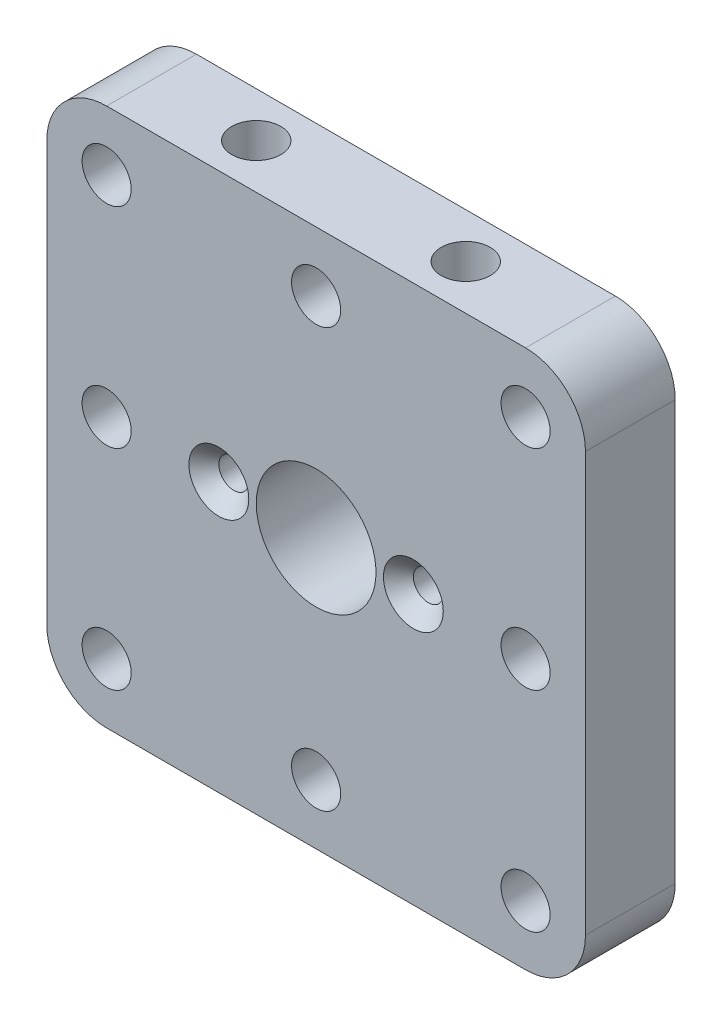
from build123d import *

# Parameters (mm, degrees)
SKETCH1_W           = 57.15
SKETCH1_H           = 57.15
SKETCH1_R           = 2.6035
SKETCH1_R_2         = 6.35
SKETCH1_R_3         = 1.5875
BOSS_EXTRUDE1_DEPTH = 9.525
CHAMFER1_SIZE       = 1.5875
FILLET1_R           = 6.35
SKETCH2_R           = 2.6035
CUT_EXTRUDE1_DEPTH  = 12.7


with BuildPart() as part:
    # Sketch1 → Boss-Extrude1 (new body)
    with BuildSketch(Plane.XY.offset(579.576994876)):
        with Locations((0, 762.756140976)):
            Rectangle(SKETCH1_W, SKETCH1_H)
        with Locations(Location((-22.225, 784.981140976, 0), (0, 0, 180))):
            Circle(SKETCH1_R, mode=Mode.SUBTRACT)
        with Locations(Location((0, 762.756140976, 0), (0, 0, 180))):
            Circle(SKETCH1_R_2, mode=Mode.SUBTRACT)
        with Locations(Location((-10.31875, 762.756140976, 0), (0, 0, 180))):
            Circle(SKETCH1_R_3, mode=Mode.SUBTRACT)
        with Locations(Location((10.31875, 762.756140976, 0), (0, 0, 180))):
            Circle(SKETCH1_R_3, mode=Mode.SUBTRACT)
        with Locations(Location((22.225, 784.981140976, 0), (0, 0, 180))):
            Circle(SKETCH1_R, mode=Mode.SUBTRACT)
        with Locations(Location((22.225, 762.756140976, 0), (0, 0, 180))):
            Circle(SKETCH1_R, mode=Mode.SUBTRACT)
        with Locations(Location((0, 784.981140976, 0), (0, 0, 180))):
            Circle(SKETCH1_R, mode=Mode.SUBTRACT)
        with Locations(Location((-22.225, 762.756140976, 0), (0, 0, 180))):
            Circle(SKETCH1_R, mode=Mode.SUBTRACT)
        with Locations(Location((22.225, 740.531140976, 0), (0, 0, 180))):
            Circle(SKETCH1_R, mode=Mode.SUBTRACT)
        with Locations(Location((0, 740.531140976, 0), (0, 0, 180))):
            Circle(SKETCH1_R, mode=Mode.SUBTRACT)
        with Locations(Location((-22.225, 740.531140976, 0), (0, 0, 180))):
            Circle(SKETCH1_R, mode=Mode.SUBTRACT)
    extrude(amount=BOSS_EXTRUDE1_DEPTH)

    # Chamfer1
    chamfer1_edges = [part.edges().sort_by_distance(p)[0] for p in [
        (-8.73125, 762.756140976, 589.101994876),
        (11.90625, 762.756140976, 589.101994876),
    ]]
    chamfer(chamfer1_edges, length=CHAMFER1_SIZE)

    # Fillet1
    fillet1_edges = [part.edges().sort_by_distance(p)[0] for p in [
        (28.575, 734.181140976, 584.339494876),
        (-28.575, 734.181140976, 584.339494876),
        (-28.575, 791.331140976, 584.339494876),
        (28.575, 791.331140976, 584.339494876),
    ]]
    fillet(fillet1_edges, radius=FILLET1_R)

    # Sketch2 → Cut-Extrude1 (cut)
    with BuildSketch(Plane(origin=(0, 791.331140976, 0), x_dir=(1, 0, 0), z_dir=(0, 1, 0))):
        with Locations(Location((-11.1125, -584.339494876, 0), (0, 0, 270))):
            Circle(SKETCH2_R)
        with Locations(Location((11.1125, -584.339494876, 0), (0, 0, 90))):
            Circle(SKETCH2_R)
    extrude(amount=-CUT_EXTRUDE1_DEPTH, mode=Mode.SUBTRACT)


solid = part.part
